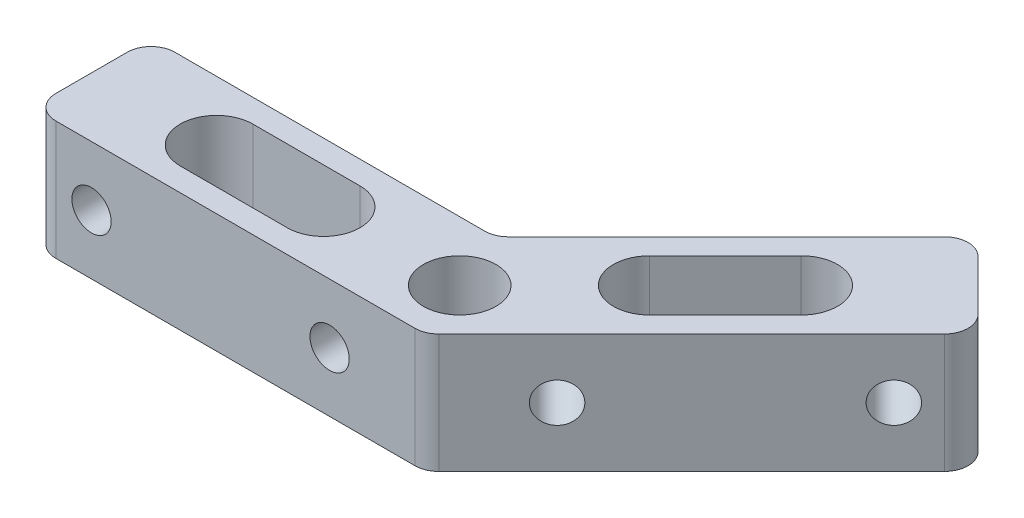
from build123d import *

# Parameters (mm, degrees)
EXTRUDE_1_DEPTH     = 10
SKETCH_2_R          = 1.65
CUT_EXTRUDE_1_DEPTH = 45.653083029
SKETCH_4_R          = 1.65
CUT_EXTRUDE_3_DEPTH = 10
SKETCH_5_R          = 3.05
CUT_EXTRUDE_4_DEPTH = 10
FILLET_2_R          = 2


with BuildPart() as part:
    # ｽｹｯﾁ1 → ﾎﾞｽ - 押し出し1 (new body)
    with BuildSketch(Plane(origin=(0, 0, 0), x_dir=(1, 0, 0), z_dir=(0, 1, 0))):
        Polygon((-25, 5), (8, 5), (31.233495706, 28.233495706), (24.162427894, 35.304563517), (3.857864376, 15), (-25, 15), align=None)
    extrude(amount=EXTRUDE_1_DEPTH)

    # ｽｹｯﾁ2 → ｶｯﾄ - 押し出し1 (cut, through all)
    with BuildSketch(Plane.XY.offset(-5)):
        with Locations((-20, 5)):
            Circle(SKETCH_2_R)
        with Locations((0, 5)):
            Circle(SKETCH_2_R)
    extrude(amount=-CUT_EXTRUDE_1_DEPTH, mode=Mode.SUBTRACT)

    # ｽｹｯﾁ4 → ｶｯﾄ - 押し出し3 (cut)
    with BuildSketch(Plane(origin=(1.5, 0, 1.5), x_dir=(0.7071067811865472, 0, -0.7071067811865479), z_dir=(0.7071067811865479, 0, 0.7071067811865472))):
        with Locations((37.049512883, 5)):
            Circle(SKETCH_4_R)
        with Locations((17.049512883, 5)):
            Circle(SKETCH_4_R)
    extrude(amount=-CUT_EXTRUDE_3_DEPTH, mode=Mode.SUBTRACT)

    # ｽｹｯﾁ5 → ｶｯﾄ - 押し出し4 (cut)
    with BuildSketch(Plane(origin=(0, 10, 0), x_dir=(1, 0, 0), z_dir=(0, 1, 0))):
        with Locations(Location((5.928932188, 10, 0), (0, 0, 270))):
            Circle(SKETCH_5_R)
        with BuildLine():
            Line((-14.5, 13.05), (-5.5, 13.05))
            ThreePointArc((-5.5, 13.05), (-2.45, 10), (-5.5, 6.95))
            Line((-5.5, 6.95), (-14.5, 6.95))
            ThreePointArc((-14.5, 6.95), (-17.55, 10), (-14.5, 13.05))
        make_face()
        with BuildLine():
            Line((22.43001628, 22.187732726), (16.066055249, 15.823771696))
            ThreePointArc((16.066055249, 15.823771696), (11.752703884, 15.823771696), (11.752703884, 20.137123061))
            Line((11.752703884, 20.137123061), (18.116664914, 26.501084092))
            ThreePointArc((18.116664914, 26.501084092), (22.43001628, 26.501084092), (22.43001628, 22.187732726))
        make_face()
    extrude(amount=-CUT_EXTRUDE_4_DEPTH, mode=Mode.SUBTRACT)

    # ﾌｨﾚｯﾄ2
    fillet_2_edges = [part.edges().sort_by_distance(p)[0] for p in [
        (-25, 5, -15),
        (3.857864376, 5, -15),
        (24.162427894, 5, -35.304563517),
        (31.233495706, 5, -28.233495706),
        (8, 5, -5),
        (-25, 5, -5),
    ]]
    fillet(fillet_2_edges, radius=FILLET_2_R)


solid = part.part
